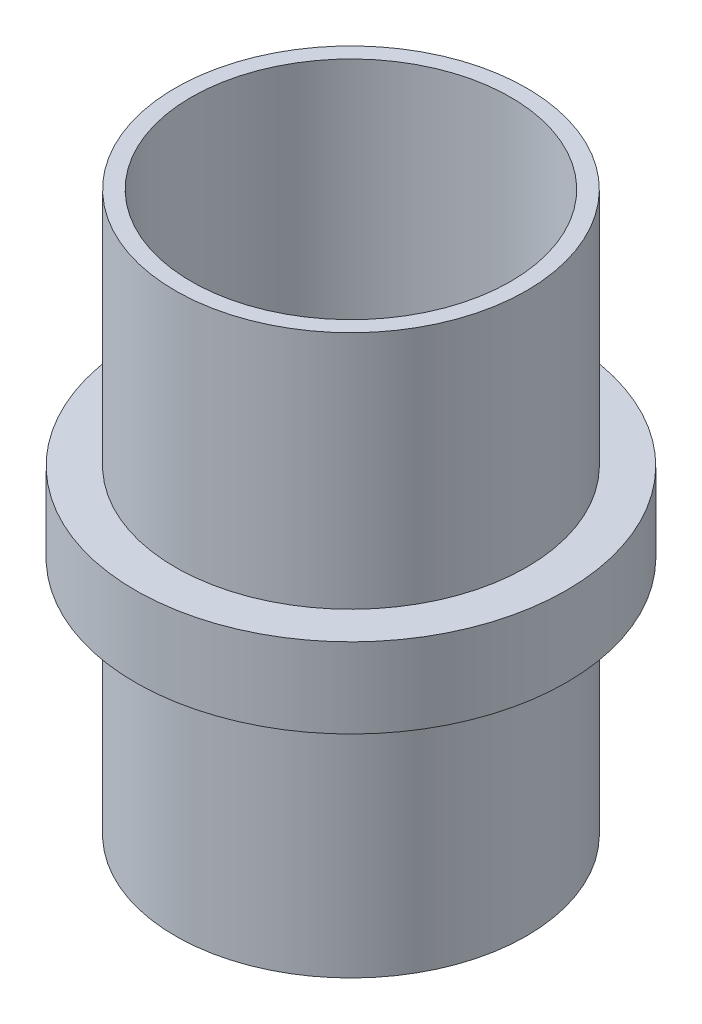
from build123d import *


with BuildPart() as part:
    # Sketch1 → Revolve1 (revolve)
    with BuildSketch(Plane.XY):
        Polygon((10, 17.5), (10, 2.5), (9, -2.5), (9, -17.5), (11, -17.5), (11, -2.5), (13.5, -2.5), (13.5, 2.5), (11, 2.5), (11, 17.5), align=None)
    revolve(axis=Axis((0, -17.5, 0), (0, 1, 0)))


solid = part.part
